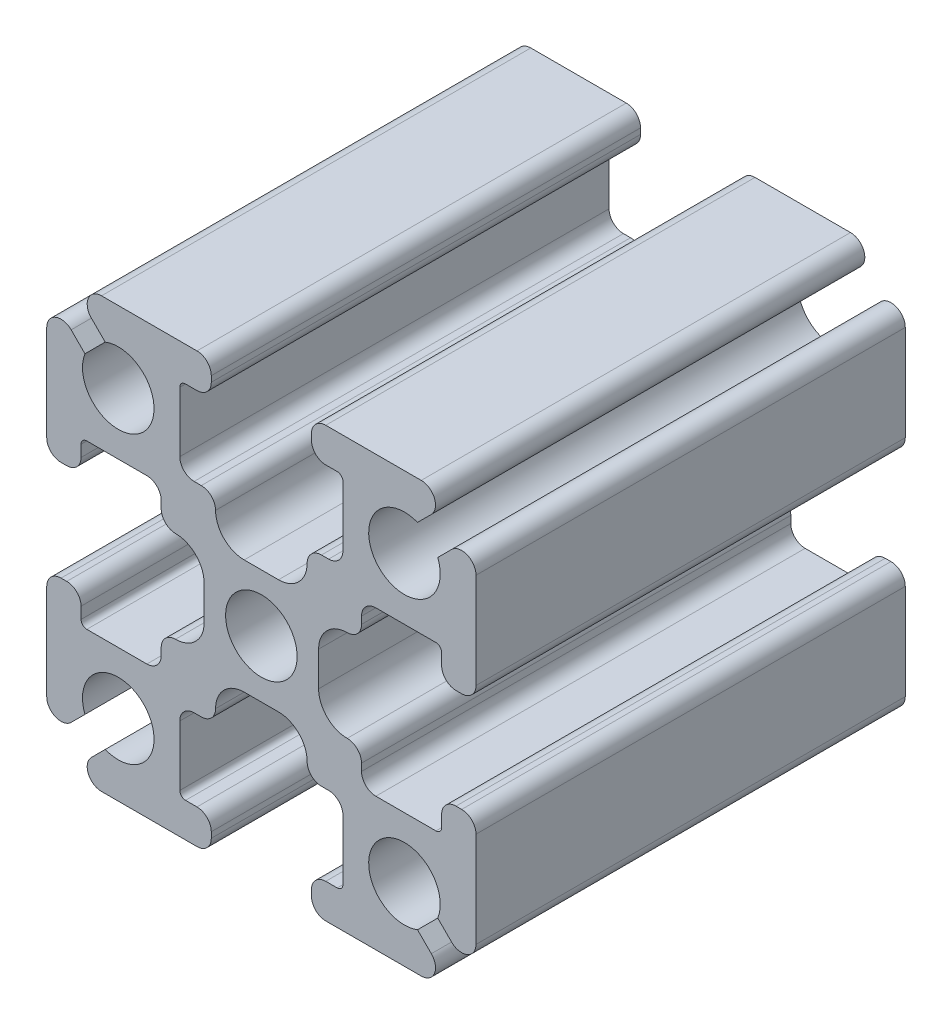
from build123d import *

# Parameters (mm, degrees)
SKETCH1_R           = 1.25
BOSS_EXTRUDE1_DEPTH = 15


with BuildPart() as part:
    # Sketch1 → Boss-Extrude1 (new body)
    with BuildSketch(Plane.XY):
        with BuildLine():
            Line((6.646446609, 5.939339828), (6.163645978, 5.456539197))
            ThreePointArc((6.163645978, 5.456539197), (4.116116524, 4.116116524), (5.456539197, 6.163645978))
            Line((5.456539197, 6.163645978), (5.939339828, 6.646446609))
            ThreePointArc((5.939339828, 6.646446609), (6.047726204, 7.191341716), (5.585786438, 7.5))
            Line((5.585786438, 7.5), (2.25, 7.5))
            ThreePointArc((2.25, 7.5), (1.896446609, 7.353553391), (1.75, 7))
            Line((1.75, 7), (1.75, 6.8))
            ThreePointArc((1.75, 6.8), (1.896446609, 6.446446609), (2.25, 6.3))
            Line((2.25, 6.3), (2.65, 6.3))
            ThreePointArc((2.65, 6.3), (2.791421356, 6.241421356), (2.85, 6.1))
            Line((2.85, 6.1), (2.85, 4))
            ThreePointArc((2.85, 4), (2.703553391, 3.646446609), (2.35, 3.5))
            Line((2.35, 3.5), (2.1, 3.5))
            ThreePointArc((2.1, 3.5), (1.746446609, 3.353553391), (1.6, 3))
            ThreePointArc((1.6, 3), (1.307106781, 2.292893219), (0.6, 2))
            Line((0.6, 2), (-0.6, 2))
            ThreePointArc((-0.6, 2), (-1.307106781, 2.292893219), (-1.6, 3))
            ThreePointArc((-1.6, 3), (-1.746446609, 3.353553391), (-2.1, 3.5))
            Line((-2.1, 3.5), (-2.35, 3.5))
            ThreePointArc((-2.35, 3.5), (-2.703553391, 3.646446609), (-2.85, 4))
            Line((-2.85, 4), (-2.85, 6.1))
            ThreePointArc((-2.85, 6.1), (-2.791421356, 6.241421356), (-2.65, 6.3))
            Line((-2.65, 6.3), (-2.25, 6.3))
            ThreePointArc((-2.25, 6.3), (-1.896446609, 6.446446609), (-1.75, 6.8))
            Line((-1.75, 6.8), (-1.75, 7))
            ThreePointArc((-1.75, 7), (-1.896446609, 7.353553391), (-2.25, 7.5))
            Line((-2.25, 7.5), (-5.585786438, 7.5))
            ThreePointArc((-5.585786438, 7.5), (-6.047726204, 7.191341716), (-5.939339828, 6.646446609))
            Line((-5.939339828, 6.646446609), (-5.456539197, 6.163645978))
            ThreePointArc((-5.456539197, 6.163645978), (-4.116116524, 4.116116524), (-6.163645978, 5.456539197))
            Line((-6.163645978, 5.456539197), (-6.646446609, 5.939339828))
            ThreePointArc((-6.646446609, 5.939339828), (-7.191341716, 6.047726204), (-7.5, 5.585786438))
            Line((-7.5, 5.585786438), (-7.5, 2.25))
            ThreePointArc((-7.5, 2.25), (-7.353553391, 1.896446609), (-7, 1.75))
            Line((-7, 1.75), (-6.8, 1.75))
            ThreePointArc((-6.8, 1.75), (-6.446446609, 1.896446609), (-6.3, 2.25))
            Line((-6.3, 2.25), (-6.3, 2.65))
            ThreePointArc((-6.3, 2.65), (-6.241421356, 2.791421356), (-6.1, 2.85))
            Line((-6.1, 2.85), (-4, 2.85))
            ThreePointArc((-4, 2.85), (-3.646446609, 2.703553391), (-3.5, 2.35))
            Line((-3.5, 2.35), (-3.5, 2.1))
            ThreePointArc((-3.5, 2.1), (-3.353553391, 1.746446609), (-3, 1.6))
            ThreePointArc((-3, 1.6), (-2.292893219, 1.307106781), (-2, 0.6))
            Line((-2, 0.6), (-2, -0.6))
            ThreePointArc((-2, -0.6), (-2.292893219, -1.307106781), (-3, -1.6))
            ThreePointArc((-3, -1.6), (-3.353553391, -1.746446609), (-3.5, -2.1))
            Line((-3.5, -2.1), (-3.5, -2.35))
            ThreePointArc((-3.5, -2.35), (-3.646446609, -2.703553391), (-4, -2.85))
            Line((-4, -2.85), (-6.1, -2.85))
            ThreePointArc((-6.1, -2.85), (-6.241421356, -2.791421356), (-6.3, -2.65))
            Line((-6.3, -2.65), (-6.3, -2.25))
            ThreePointArc((-6.3, -2.25), (-6.446446609, -1.896446609), (-6.8, -1.75))
            Line((-6.8, -1.75), (-7, -1.75))
            ThreePointArc((-7, -1.75), (-7.353553391, -1.896446609), (-7.5, -2.25))
            Line((-7.5, -2.25), (-7.5, -5.585786438))
            ThreePointArc((-7.5, -5.585786438), (-7.191341716, -6.047726204), (-6.646446609, -5.939339828))
            Line((-6.646446609, -5.939339828), (-6.163645978, -5.456539197))
            ThreePointArc((-6.163645978, -5.456539197), (-4.116116524, -4.116116524), (-5.456539197, -6.163645978))
            Line((-5.456539197, -6.163645978), (-5.939339828, -6.646446609))
            ThreePointArc((-5.939339828, -6.646446609), (-6.047726204, -7.191341716), (-5.585786438, -7.5))
            Line((-5.585786438, -7.5), (-2.25, -7.5))
            ThreePointArc((-2.25, -7.5), (-1.896446609, -7.353553391), (-1.75, -7))
            Line((-1.75, -7), (-1.75, -6.8))
            ThreePointArc((-1.75, -6.8), (-1.896446609, -6.446446609), (-2.25, -6.3))
            Line((-2.25, -6.3), (-2.65, -6.3))
            ThreePointArc((-2.65, -6.3), (-2.791421356, -6.241421356), (-2.85, -6.1))
            Line((-2.85, -6.1), (-2.85, -4))
            ThreePointArc((-2.85, -4), (-2.703553391, -3.646446609), (-2.35, -3.5))
            Line((-2.35, -3.5), (-2.1, -3.5))
            ThreePointArc((-2.1, -3.5), (-1.746446609, -3.353553391), (-1.6, -3))
            ThreePointArc((-1.6, -3), (-1.307106781, -2.292893219), (-0.6, -2))
            Line((-0.6, -2), (0.6, -2))
            ThreePointArc((0.6, -2), (1.307106781, -2.292893219), (1.6, -3))
            ThreePointArc((1.6, -3), (1.746446609, -3.353553391), (2.1, -3.5))
            Line((2.1, -3.5), (2.35, -3.5))
            ThreePointArc((2.35, -3.5), (2.703553391, -3.646446609), (2.85, -4))
            Line((2.85, -4), (2.85, -6.1))
            ThreePointArc((2.85, -6.1), (2.791421356, -6.241421356), (2.65, -6.3))
            Line((2.65, -6.3), (2.25, -6.3))
            ThreePointArc((2.25, -6.3), (1.896446609, -6.446446609), (1.75, -6.8))
            Line((1.75, -6.8), (1.75, -7))
            ThreePointArc((1.75, -7), (1.896446609, -7.353553391), (2.25, -7.5))
            Line((2.25, -7.5), (5.585786438, -7.5))
            ThreePointArc((5.585786438, -7.5), (6.047726204, -7.191341716), (5.939339828, -6.646446609))
            Line((5.939339828, -6.646446609), (5.456539197, -6.163645978))
            ThreePointArc((5.456539197, -6.163645978), (4.116116524, -4.116116524), (6.163645978, -5.456539197))
            Line((6.163645978, -5.456539197), (6.646446609, -5.939339828))
            ThreePointArc((6.646446609, -5.939339828), (7.191341716, -6.047726204), (7.5, -5.585786438))
            Line((7.5, -5.585786438), (7.5, -2.25))
            ThreePointArc((7.5, -2.25), (7.353553391, -1.896446609), (7, -1.75))
            Line((7, -1.75), (6.8, -1.75))
            ThreePointArc((6.8, -1.75), (6.446446609, -1.896446609), (6.3, -2.25))
            Line((6.3, -2.25), (6.3, -2.65))
            ThreePointArc((6.3, -2.65), (6.241421356, -2.791421356), (6.1, -2.85))
            Line((6.1, -2.85), (4, -2.85))
            ThreePointArc((4, -2.85), (3.646446609, -2.703553391), (3.5, -2.35))
            Line((3.5, -2.35), (3.5, -2.1))
            ThreePointArc((3.5, -2.1), (3.353553391, -1.746446609), (3, -1.6))
            ThreePointArc((3, -1.6), (2.292893219, -1.307106781), (2, -0.6))
            Line((2, -0.6), (2, 0.6))
            ThreePointArc((2, 0.6), (2.292893219, 1.307106781), (3, 1.6))
            ThreePointArc((3, 1.6), (3.353553391, 1.746446609), (3.5, 2.1))
            Line((3.5, 2.1), (3.5, 2.35))
            ThreePointArc((3.5, 2.35), (3.646446609, 2.703553391), (4, 2.85))
            Line((4, 2.85), (6.1, 2.85))
            ThreePointArc((6.1, 2.85), (6.241421356, 2.791421356), (6.3, 2.65))
            Line((6.3, 2.65), (6.3, 2.25))
            ThreePointArc((6.3, 2.25), (6.446446609, 1.896446609), (6.8, 1.75))
            Line((6.8, 1.75), (7, 1.75))
            ThreePointArc((7, 1.75), (7.353553391, 1.896446609), (7.5, 2.25))
            Line((7.5, 2.25), (7.5, 5.585786438))
            ThreePointArc((7.5, 5.585786438), (7.191341716, 6.047726204), (6.646446609, 5.939339828))
        make_face()
        with Locations(Location((0, 0, 0), (0, 0, 180))):
            Circle(SKETCH1_R, mode=Mode.SUBTRACT)
    extrude(amount=BOSS_EXTRUDE1_DEPTH)


solid = part.part
